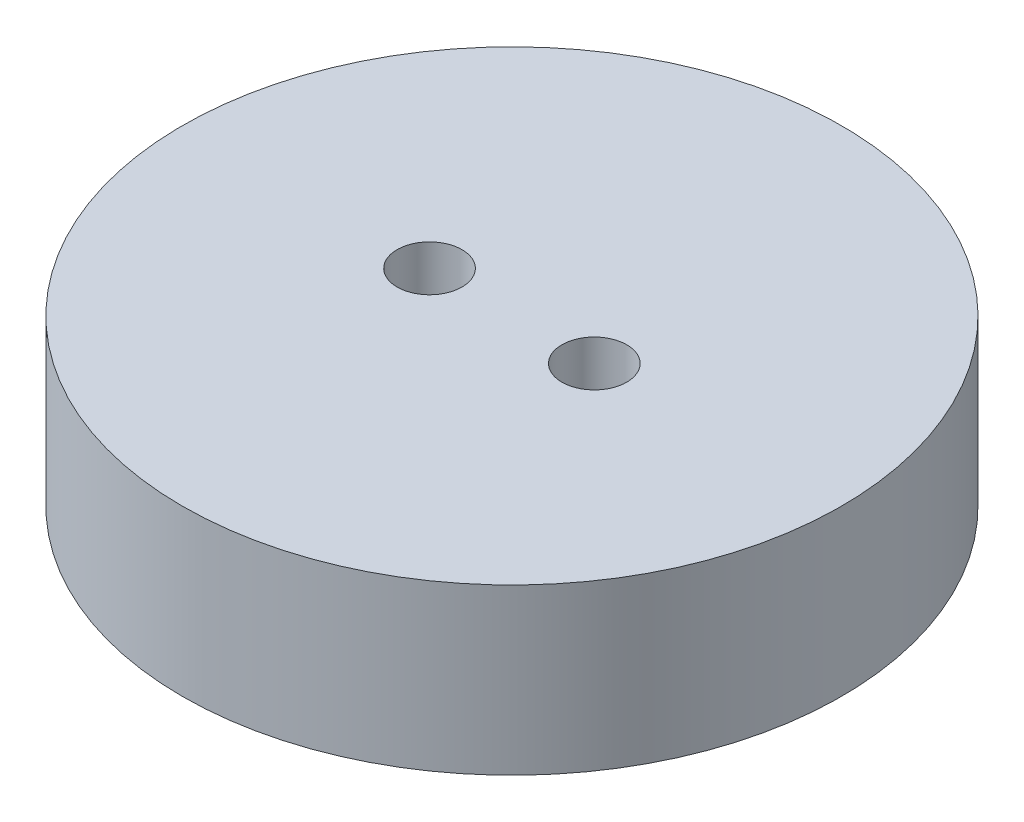
from build123d import *

# Parameters (mm, degrees)
SKETCH1_R             = 25.4
BOSS_EXTRUDE1_DEPTH   = 12.7
M6X1_0_TAPPED_HOLE1_D = 5


with BuildPart() as part:
    # Sketch1 → Boss-Extrude1 (new body)
    with BuildSketch(Plane(origin=(0, 0, 0), x_dir=(1, 0, 0), z_dir=(0, 1, 0))):
        with Locations(Location((0, 0, 0), (0, 0, 270))):
            Circle(SKETCH1_R)
    extrude(amount=BOSS_EXTRUDE1_DEPTH)

    # M6x1.0 Tapped Hole1 (through all)
    with Locations(Plane(origin=(0, 12.7, 0), x_dir=(1, 0, 0), z_dir=(0, 1, 0))):
        with Locations((-6.35, 0), (6.35, 0)):
            Hole(M6X1_0_TAPPED_HOLE1_D / 2)


solid = part.part
